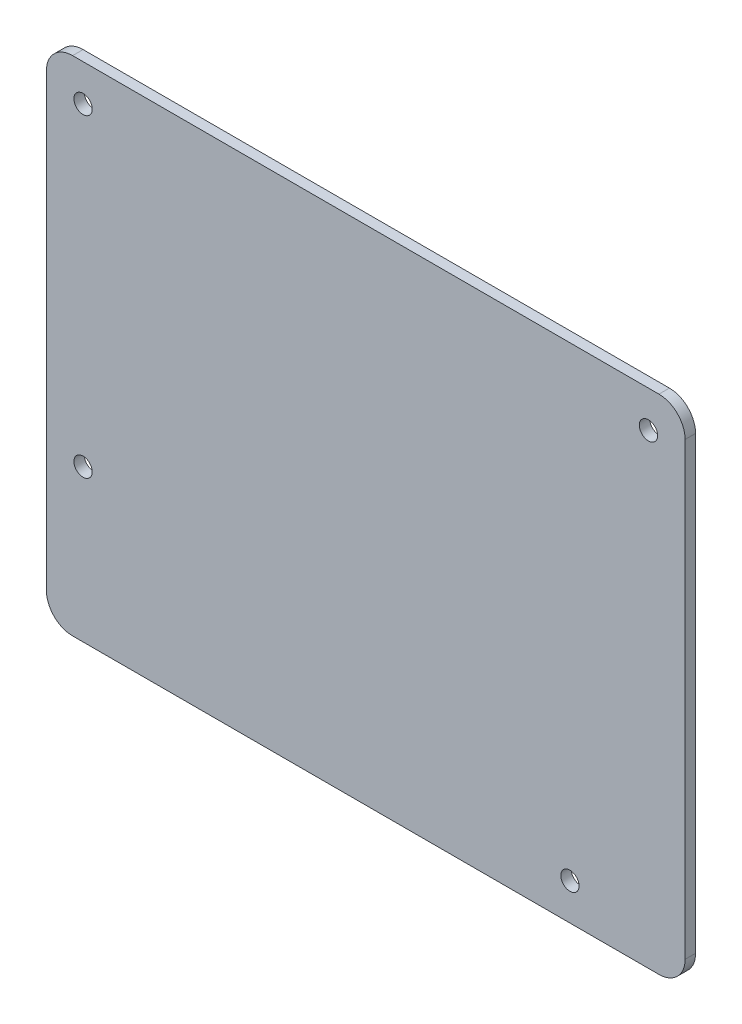
from build123d import *

# Parameters (mm, degrees)
SKETCH1_W                  = 122
SKETCH1_H                  = 96
BOSS_EXTRUDE1_DEPTH        = 2
F_3_5_3_5_DIAMETER_HOLE1_D = 3.5
FILLET1_R                  = 5


with BuildPart() as part:
    # Sketch1 → Boss-Extrude1 (new body)
    with BuildSketch(Plane.XY):
        with Locations((-39, 41)):
            Rectangle(SKETCH1_W, SKETCH1_H)
    extrude(amount=BOSS_EXTRUDE1_DEPTH)

    # Ø3.5 (3.5) Diameter Hole1 (through all)
    with Locations(Plane.XY.offset(2)):
        with Locations((0, 0), (15, 82), (-93, 82), (-93, 22)):
            Hole(F_3_5_3_5_DIAMETER_HOLE1_D / 2)

    # Fillet1
    fillet1_edges = [part.edges().sort_by_distance(p)[0] for p in [
        (-100, 89, 1),
        (22, 89, 1),
        (22, -7, 1),
        (-100, -7, 1),
    ]]
    fillet(fillet1_edges, radius=FILLET1_R)


solid = part.part
